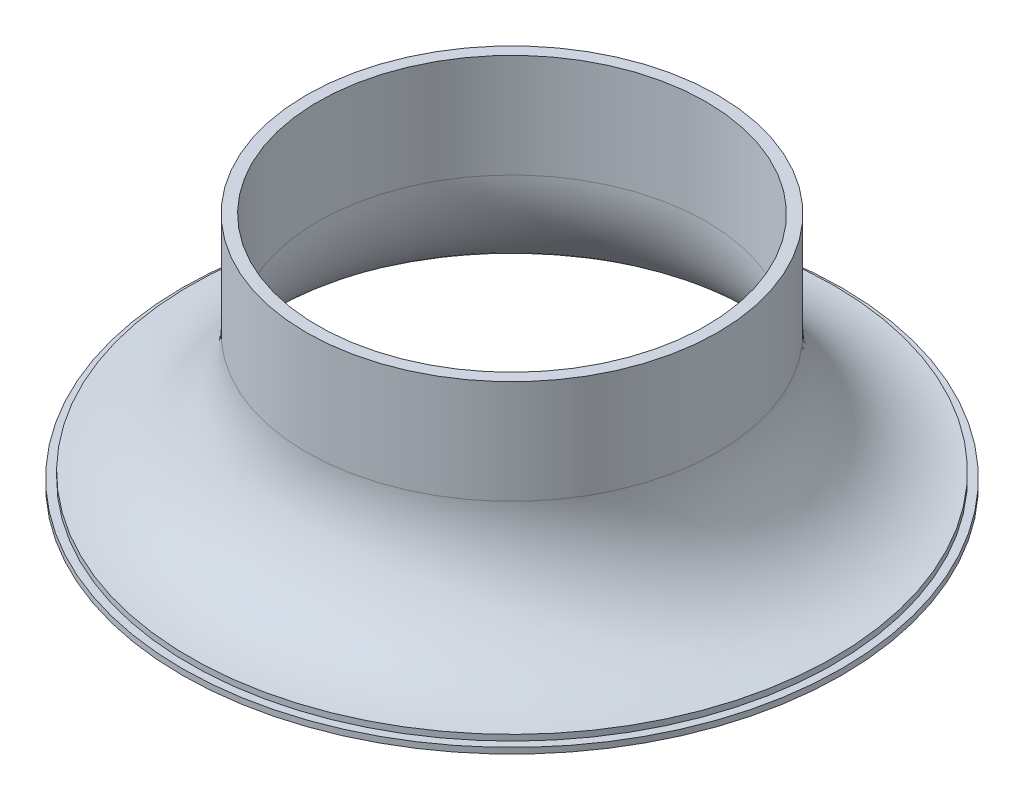
from build123d import *


with BuildPart() as part:
    # Çizim1 → Döndür1 (revolve)
    with BuildSketch(Plane.XY, mode=Mode.PRIVATE) as d_nd_r1_sk:
        with BuildLine():
            Line((-25.1, 9.270415491), (-25.1, -4.129584509))
            ThreePointArc((-25.1, -4.129584509), (-30.067468991, -16.122115518), (-42.06, -21.089584509))
            Line((-42.06, -21.089584509), (-42.65, -21.089584509))
            Line((-42.65, -21.089584509), (-42.65, -20.339584509))
            Line((-42.65, -20.339584509), (-42.06, -20.339584509))
            Line((-42.06, -20.339584509), (-41.65, -20.339584509))
            Line((-41.65, -20.339584509), (-41.65, -19.584146943))
            ThreePointArc((-41.65, -19.584146943), (-30.984120802, -14.915524431), (-26.6, -4.129584509))
            Line((-26.6, -4.129584509), (-26.6, 9.270415491))
            Line((-26.6, 9.270415491), (-25.1, 9.270415491))
        make_face()
    revolve(d_nd_r1_sk.sketch.rotate(Axis((0, 0, 0), (0, 1, 0)), 270), axis=Axis((0, 0, 0), (0, 1, 0)))


solid = part.part
